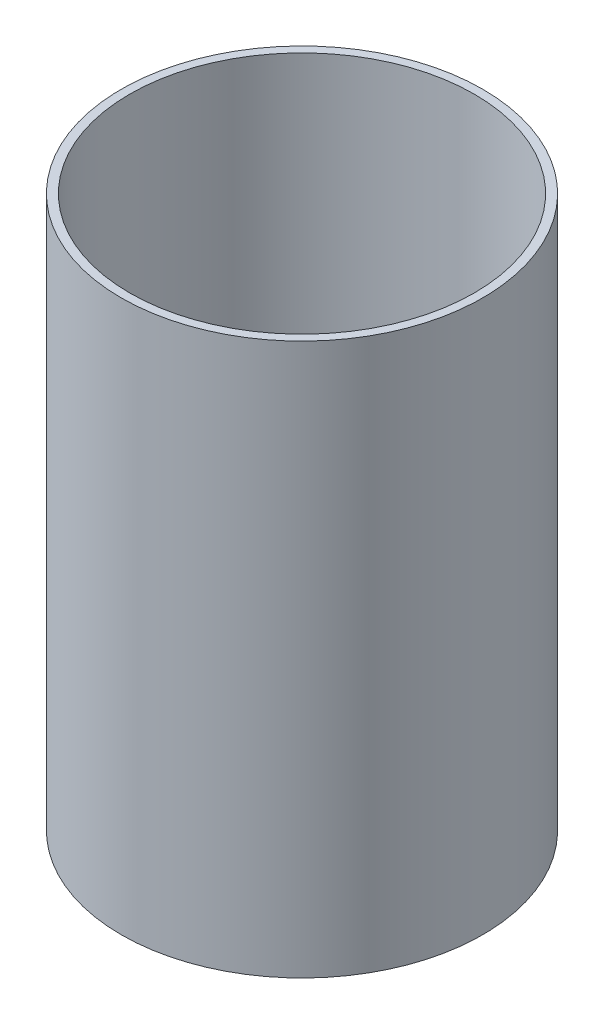
from build123d import *

# Parameters (mm, degrees)
SKETCH2_R           = 10.65
SKETCH2_R_2         = 10.15
BOSS_EXTRUDE1_DEPTH = 32.5


with BuildPart() as part:
    # Sketch2 → Boss-Extrude1 (new body)
    with BuildSketch(Plane(origin=(0, 0, 0), x_dir=(1, 0, 0), z_dir=(0, 1, 0))):
        with Locations(Location((0, 0, 0), (0, 0, 270))):
            Circle(SKETCH2_R)
        with Locations(Location((0, 0, 0), (0, 0, 270))):
            Circle(SKETCH2_R_2, mode=Mode.SUBTRACT)
    extrude(amount=BOSS_EXTRUDE1_DEPTH)


solid = part.part
